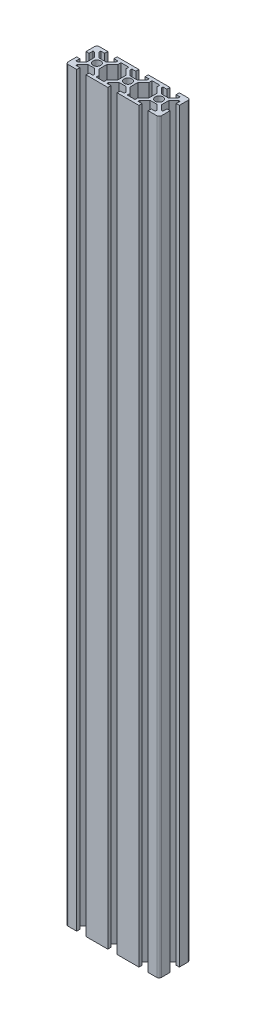
from build123d import *

# Parameters (mm, degrees)
SKETCH1_R           = 2.5
BOSS_EXTRUDE1_DEPTH = 240


with BuildPart() as part:
    # Sketch1 → Boss-Extrude1 (new, symmetric)
    with BuildSketch(Plane(origin=(0, 0, 0), x_dir=(1, 0, 0), z_dir=(0, 1, 0))):
        with BuildLine():
            Line((-2.185786438, 3.6), (2.185786438, 3.6))
            Line((2.185786438, 3.6), (5.5, 6.914213562))
            Line((5.5, 6.914213562), (5.5, 8))
            Line((5.5, 8), (3, 8))
            Line((3, 8), (3, 10))
            Line((3, 10), (17, 10))
            Line((17, 10), (17, 8))
            Line((17, 8), (14.5, 8))
            Line((14.5, 8), (14.5, 6.914213562))
            Line((14.5, 6.914213562), (17.814213562, 3.6))
            Line((17.814213562, 3.6), (22.185786438, 3.6))
            Line((22.185786438, 3.6), (25.5, 6.914213562))
            Line((25.5, 6.914213562), (25.5, 8))
            Line((25.5, 8), (23, 8))
            Line((23, 8), (23, 10))
            Line((23, 10), (28.5, 10))
            ThreePointArc((28.5, 10), (29.560660172, 9.560660172), (30, 8.5))
            Line((30, 8.5), (30, 3))
            Line((30, 3), (28, 3))
            Line((28, 3), (28, 5.5))
            Line((28, 5.5), (26.914213562, 5.5))
            Line((26.914213562, 5.5), (23.914213562, 2.5))
            Line((23.914213562, 2.5), (23.914213562, -2.5))
            Line((23.914213562, -2.5), (26.914213562, -5.5))
            Line((26.914213562, -5.5), (28, -5.5))
            Line((28, -5.5), (28, -3))
            Line((28, -3), (30, -3))
            Line((30, -3), (30, -8.5))
            ThreePointArc((30, -8.5), (29.560660172, -9.560660172), (28.5, -10))
            Line((28.5, -10), (23, -10))
            Line((23, -10), (23, -8))
            Line((23, -8), (25.5, -8))
            Line((25.5, -8), (25.5, -6.914213562))
            Line((25.5, -6.914213562), (22.185786438, -3.6))
            Line((22.185786438, -3.6), (17.814213562, -3.6))
            Line((17.814213562, -3.6), (14.5, -6.914213562))
            Line((14.5, -6.914213562), (14.5, -8))
            Line((14.5, -8), (17, -8))
            Line((17, -8), (17, -10))
            Line((17, -10), (3, -10))
            Line((3, -10), (3, -8))
            Line((3, -8), (5.5, -8))
            Line((5.5, -8), (5.5, -6.914213562))
            Line((5.5, -6.914213562), (2.185786438, -3.6))
            Line((2.185786438, -3.6), (-2.185786438, -3.6))
            Line((-2.185786438, -3.6), (-5.5, -6.914213562))
            Line((-5.5, -6.914213562), (-5.5, -8))
            Line((-5.5, -8), (-3, -8))
            Line((-3, -8), (-3, -10))
            Line((-3, -10), (-17, -10))
            Line((-17, -10), (-17, -8))
            Line((-17, -8), (-14.5, -8))
            Line((-14.5, -8), (-14.5, -6.914213562))
            Line((-14.5, -6.914213562), (-17.814213562, -3.6))
            Line((-17.814213562, -3.6), (-22.185786438, -3.6))
            Line((-22.185786438, -3.6), (-25.5, -6.914213562))
            Line((-25.5, -6.914213562), (-25.5, -8))
            Line((-25.5, -8), (-23, -8))
            Line((-23, -8), (-23, -10))
            Line((-23, -10), (-28.5, -10))
            ThreePointArc((-28.5, -10), (-29.560660172, -9.560660172), (-30, -8.5))
            Line((-30, -8.5), (-30, -3))
            Line((-30, -3), (-28, -3))
            Line((-28, -3), (-28, -5.5))
            Line((-28, -5.5), (-26.914213562, -5.5))
            Line((-26.914213562, -5.5), (-23.914213562, -2.5))
            Line((-23.914213562, -2.5), (-23.914213562, 2.5))
            Line((-23.914213562, 2.5), (-26.914213562, 5.5))
            Line((-26.914213562, 5.5), (-28, 5.5))
            Line((-28, 5.5), (-28, 3))
            Line((-28, 3), (-30, 3))
            Line((-30, 3), (-30, 8.5))
            ThreePointArc((-30, 8.5), (-29.560660172, 9.560660172), (-28.5, 10))
            Line((-28.5, 10), (-23, 10))
            Line((-23, 10), (-23, 8))
            Line((-23, 8), (-25.5, 8))
            Line((-25.5, 8), (-25.5, 6.914213562))
            Line((-25.5, 6.914213562), (-22.185786438, 3.6))
            Line((-22.185786438, 3.6), (-17.814213562, 3.6))
            Line((-17.814213562, 3.6), (-14.5, 6.914213562))
            Line((-14.5, 6.914213562), (-14.5, 8))
            Line((-14.5, 8), (-17, 8))
            Line((-17, 8), (-17, 10))
            Line((-17, 10), (-3, 10))
            Line((-3, 10), (-3, 8))
            Line((-3, 8), (-5.5, 8))
            Line((-5.5, 8), (-5.5, 6.914213562))
            Line((-5.5, 6.914213562), (-2.185786438, 3.6))
        make_face()
        with Locations(Location((0, 0, 0), (0, 0, 270))):
            Circle(SKETCH1_R, mode=Mode.SUBTRACT)
        with Locations(Location((20, 0, 0), (0, 0, 270))):
            Circle(SKETCH1_R, mode=Mode.SUBTRACT)
        with Locations(Location((-20, 0, 0), (0, 0, 270))):
            Circle(SKETCH1_R, mode=Mode.SUBTRACT)
        Polygon((7.5, 8), (12.5, 8), (12.5, 6.085786438), (16.085786438, 2.5), (16.085786438, -2.5), (12.5, -6.085786438), (12.5, -8), (7.5, -8), (7.5, -6.085786438), (3.914213562, -2.5), (3.914213562, 2.5), (7.5, 6.085786438), align=None, mode=Mode.SUBTRACT)
        Polygon((-7.5, -6.085786438), (-3.914213562, -2.5), (-3.914213562, 2.5), (-7.5, 6.085786438), (-7.5, 8), (-12.5, 8), (-12.5, 6.085786438), (-16.085786438, 2.5), (-16.085786438, -2.5), (-12.5, -6.085786438), (-12.5, -8), (-7.5, -8), align=None, mode=Mode.SUBTRACT)
    extrude(amount=BOSS_EXTRUDE1_DEPTH, both=True)


solid = part.part
